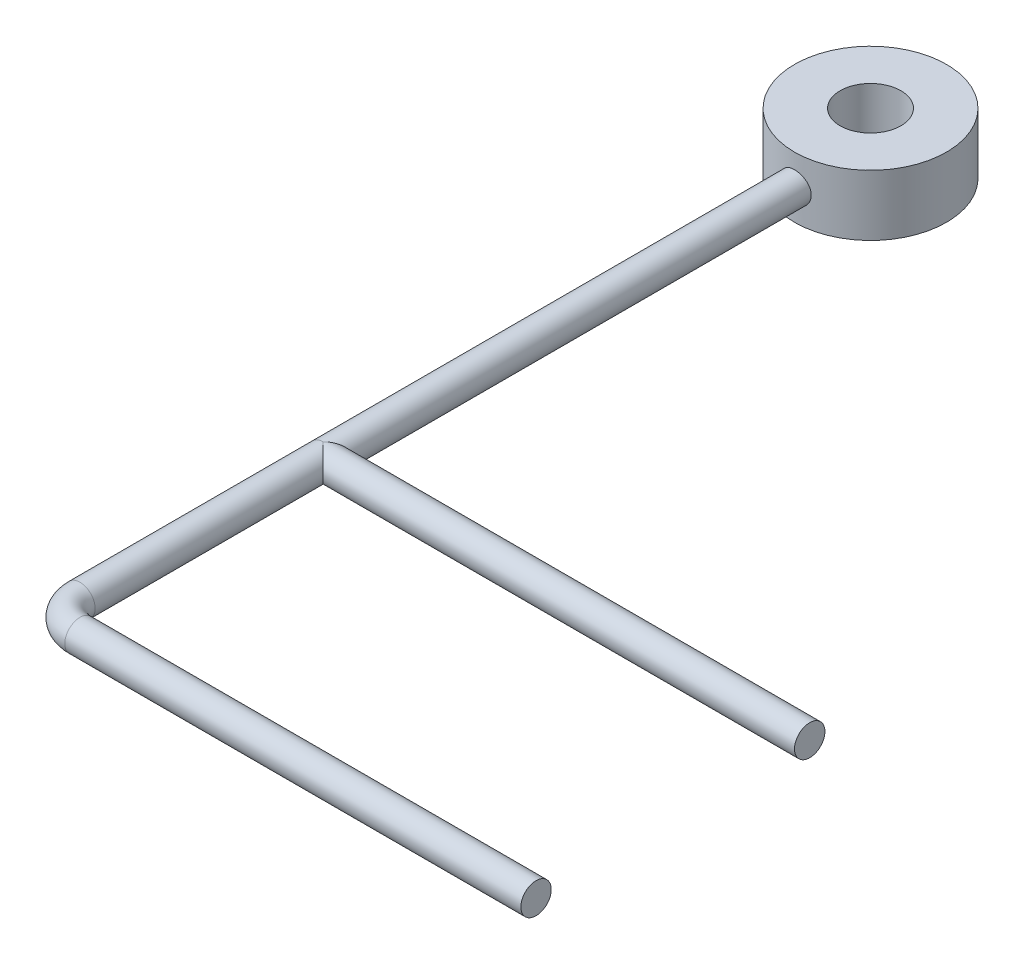
from build123d import *

# Parameters (mm, degrees)
SKETCH2_R                = 2.5
SKETCH3_R                = 2.5
BOSS_EXTRUDE1_DEPTH      = 5
BOSS_EXTRUDE1_DEPTH_BACK = 5
SKETCH4_R                = 12.5
SKETCH5_R                = 5
CUT_EXTRUDE1_DEPTH       = 160.393381385


with BuildPart() as part:
    # Sweep1: sweep along a path in Sketch1
    with BuildLine(Plane(origin=(0, 0, 0), x_dir=(1, 0, 0), z_dir=(0, 1, 0))) as sweep1_path:
        Line((0, 0), (0, -90))
        Line((0, -90), (0, -130))
        ThreePointArc((0, -130), (1.464466094, -133.535533906), (5, -135))
        Line((5, -135), (80, -135))
    # Sketch2 → Sweep1 (sweep)
    with BuildSketch(Plane(origin=(80, 0, 135), x_dir=(0, 0, -1), z_dir=(1, 0, 0))):
        Circle(SKETCH2_R)
    sweep(path=sweep1_path.line)

    # Sweep2: sweep along a path in Sketch1<4>
    with BuildLine(Plane(origin=(0, 0, 0), x_dir=(1, 0, 0), z_dir=(0, 1, 0))) as sweep2_path:
        Line((0, -90), (80, -90))
    # Sketch3 → Sweep2 (sweep)
    with BuildSketch(Plane(origin=(80, 0, 135), x_dir=(0, 0, -1), z_dir=(1, 0, 0))):
        with Locations((45, 0)):
            Circle(SKETCH3_R)
    sweep(path=sweep2_path.line)

    # Sketch4 → Boss-Extrude1 (add, two sides: drawn at the far end of the back side and taken through both)
    with BuildSketch(Plane(origin=(0, 0, 0), x_dir=(1, 0, 0), z_dir=(0, 1, 0)).offset(-BOSS_EXTRUDE1_DEPTH_BACK)):
        Circle(SKETCH4_R)
    extrude(amount=BOSS_EXTRUDE1_DEPTH + BOSS_EXTRUDE1_DEPTH_BACK)

    # Sketch5 → Cut-Extrude1 (cut, through all)
    with BuildSketch(Plane(origin=(0, 5, 0), x_dir=(1, 0, 0), z_dir=(0, 1, 0))):
        Circle(SKETCH5_R)
    extrude(amount=-CUT_EXTRUDE1_DEPTH, mode=Mode.SUBTRACT)


solid = part.part
